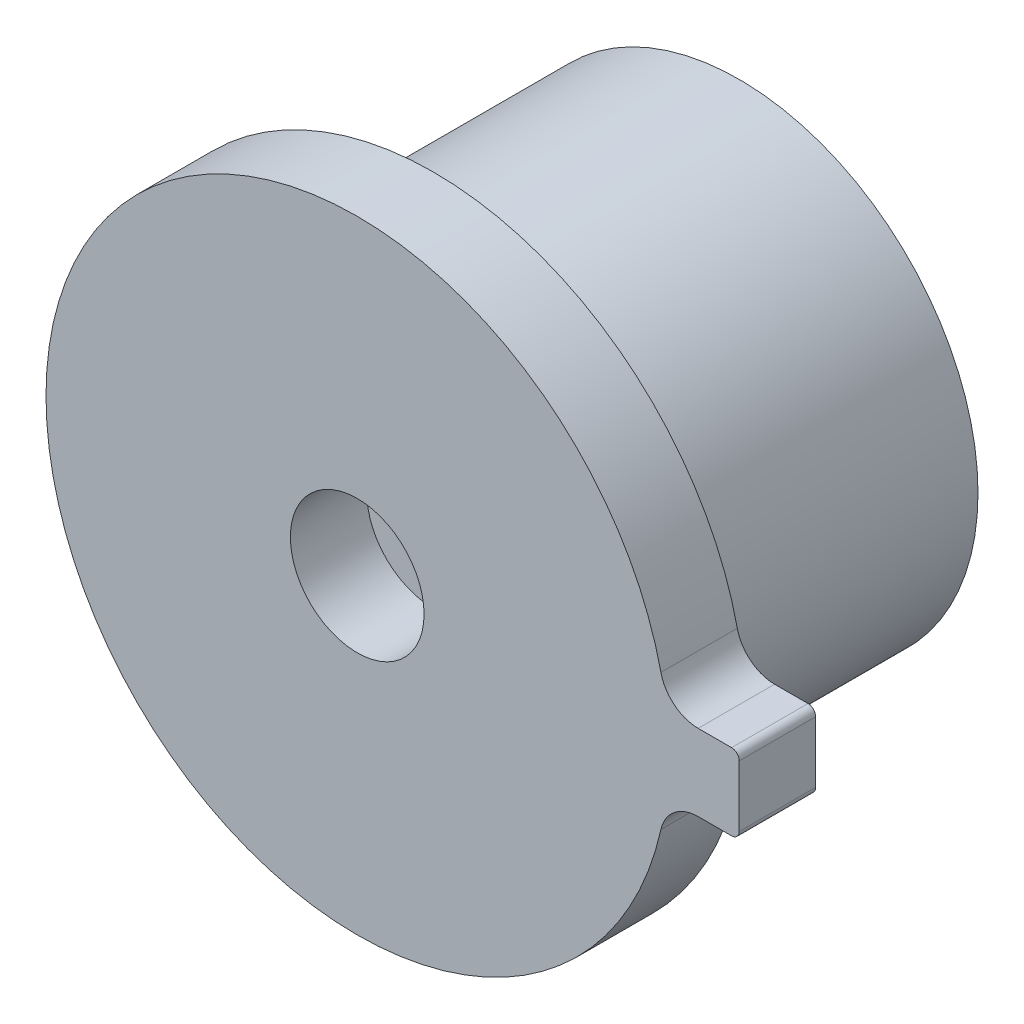
from build123d import *

# Parameters (mm, degrees)
ESQUISSE1_R             = 12.5
ESQUISSE1_R_2           = 2
BOSS_EXTRU_1_DEPTH      = 16
ESQUISSE2_R             = 16.293222759
ESQUISSE2_R_2           = 2
BOSS_EXTRU_2_DEPTH      = 4
ESQUISSE3_R             = 3.5
ENL_V_MAT_EXTRU_1_DEPTH = 4
ESQUISSE4_W             = 7.413554481
ESQUISSE4_H             = 4
BOSS_EXTRU_3_DEPTH      = 4
CONG_1_R                = 2
CONG_2_R                = 0.4
ESQUISSE5_R             = 2.75
ENL_V_MAT_EXTRU_2_DEPTH = 5


with BuildPart() as part:
    # Esquisse1 → Boss.-Extru.1 (new body)
    with BuildSketch(Plane.XY):
        Circle(ESQUISSE1_R)
        Circle(ESQUISSE1_R_2, mode=Mode.SUBTRACT)
    extrude(amount=BOSS_EXTRU_1_DEPTH)

    # Esquisse2 → Boss.-Extru.2 (add)
    with BuildSketch(Plane.XY.offset(16)):
        Circle(ESQUISSE2_R)
        Circle(ESQUISSE2_R_2, mode=Mode.SUBTRACT)
    extrude(amount=BOSS_EXTRU_2_DEPTH)

    # Esquisse3 → Enlèv. mat.-Extru.1 (cut)
    with BuildSketch(Plane.XY.offset(20)):
        Circle(ESQUISSE3_R)
    extrude(amount=-ENL_V_MAT_EXTRU_1_DEPTH, mode=Mode.SUBTRACT)

    # Esquisse4 → Boss.-Extru.3 (add)
    with BuildSketch(Plane.XY.offset(20)):
        with Locations((16.29322276, 0)):
            Rectangle(ESQUISSE4_W, ESQUISSE4_H)
    extrude(amount=-BOSS_EXTRU_3_DEPTH)

    # Congé1
    cong_1_edges = [part.edges().sort_by_distance(p)[0] for p in [
        (16.170006428, -2, 18),
        (16.170006428, 2, 18),
    ]]
    fillet(cong_1_edges, radius=CONG_1_R)

    # Congé2
    cong_2_edges = [part.edges().sort_by_distance(p)[0] for p in [
        (20, -2, 18),
        (20, 2, 18),
    ]]
    fillet(cong_2_edges, radius=CONG_2_R)

    # Esquisse5 → Enlèv. mat.-Extru.2 (cut)
    with BuildSketch(Plane(origin=(0, 0, 0), x_dir=(-1, 0, 0), z_dir=(0, 0, -1))):
        with Locations((-6, 0)):
            Circle(ESQUISSE5_R)
        with Locations((3, 5.196152423)):
            Circle(ESQUISSE5_R)
        with Locations((3, -5.196152423)):
            Circle(ESQUISSE5_R)
    extrude(amount=-ENL_V_MAT_EXTRU_2_DEPTH, mode=Mode.SUBTRACT)


solid = part.part
